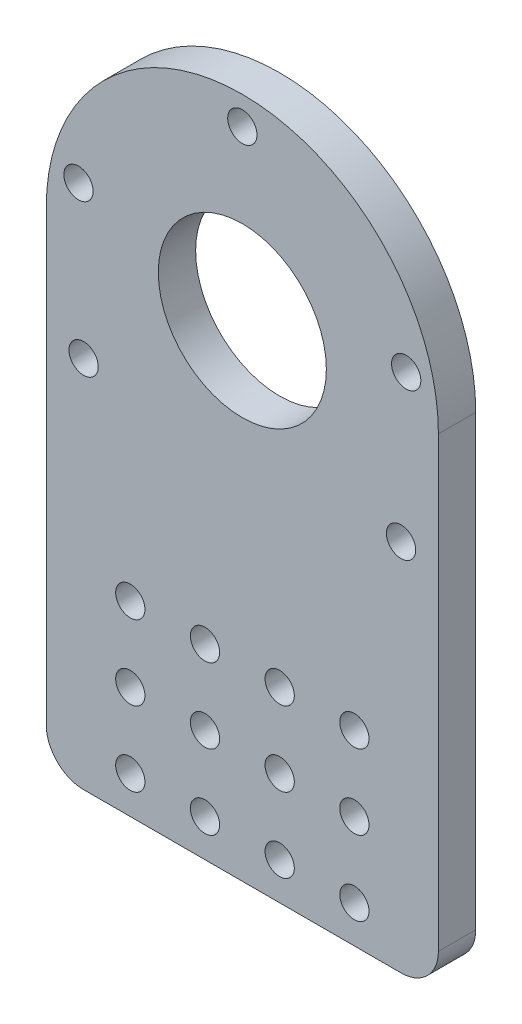
from build123d import *

# Parameters (mm, degrees)
SKETCH1_R           = 14.2875
SKETCH1_R_2         = 2.4892
BOSS_EXTRUDE1_DEPTH = 3.175
FILLET1_R           = 6.35


with BuildPart() as part:
    # Sketch1 → Boss-Extrude1 (new, symmetric)
    with BuildSketch(Plane.XY):
        with BuildLine():
            Line((33.3375, 0), (33.3375, -82.55))
            Line((33.3375, -82.55), (-33.3375, -82.55))
            Line((-33.3375, -82.55), (-33.3375, 0))
            ThreePointArc((-33.3375, 0), (0, 33.3375), (33.3375, 0))
        make_face()
        Circle(SKETCH1_R, mode=Mode.SUBTRACT)
        with Locations((-19.05, -76.2)):
            Circle(SKETCH1_R_2, mode=Mode.SUBTRACT)
        with Locations((-6.35, -76.2)):
            Circle(SKETCH1_R_2, mode=Mode.SUBTRACT)
        with Locations((-6.35, -63.5)):
            Circle(SKETCH1_R_2, mode=Mode.SUBTRACT)
        with Locations((-19.05, -63.5)):
            Circle(SKETCH1_R_2, mode=Mode.SUBTRACT)
        with Locations((6.35, -76.2)):
            Circle(SKETCH1_R_2, mode=Mode.SUBTRACT)
        with Locations((6.35, -63.5)):
            Circle(SKETCH1_R_2, mode=Mode.SUBTRACT)
        with Locations((-19.05, -50.8)):
            Circle(SKETCH1_R_2, mode=Mode.SUBTRACT)
        with Locations((-6.35, -50.8)):
            Circle(SKETCH1_R_2, mode=Mode.SUBTRACT)
        with Locations((6.35, -50.8)):
            Circle(SKETCH1_R_2, mode=Mode.SUBTRACT)
        with Locations((26.9875, -19.05)):
            Circle(SKETCH1_R_2, mode=Mode.SUBTRACT)
        with Locations((19.05, -76.2)):
            Circle(SKETCH1_R_2, mode=Mode.SUBTRACT)
        with Locations((19.05, -63.5)):
            Circle(SKETCH1_R_2, mode=Mode.SUBTRACT)
        with Locations((19.05, -50.8)):
            Circle(SKETCH1_R_2, mode=Mode.SUBTRACT)
        with Locations((0, 28.575)):
            Circle(SKETCH1_R_2, mode=Mode.SUBTRACT)
        with Locations((-27.86051193, 6.35)):
            Circle(SKETCH1_R_2, mode=Mode.SUBTRACT)
        with Locations((27.86051193, 6.35)):
            Circle(SKETCH1_R_2, mode=Mode.SUBTRACT)
        with Locations(Location((-26.9875, -19.05, 0), (0, 0, 180))):
            Circle(SKETCH1_R_2, mode=Mode.SUBTRACT)
    extrude(amount=BOSS_EXTRUDE1_DEPTH, both=True)

    # Fillet1
    fillet1_edges = [part.edges().sort_by_distance(p)[0] for p in [
        (33.3375, -82.55, 0),
        (-33.3375, -82.55, 0),
    ]]
    fillet(fillet1_edges, radius=FILLET1_R)


solid = part.part
